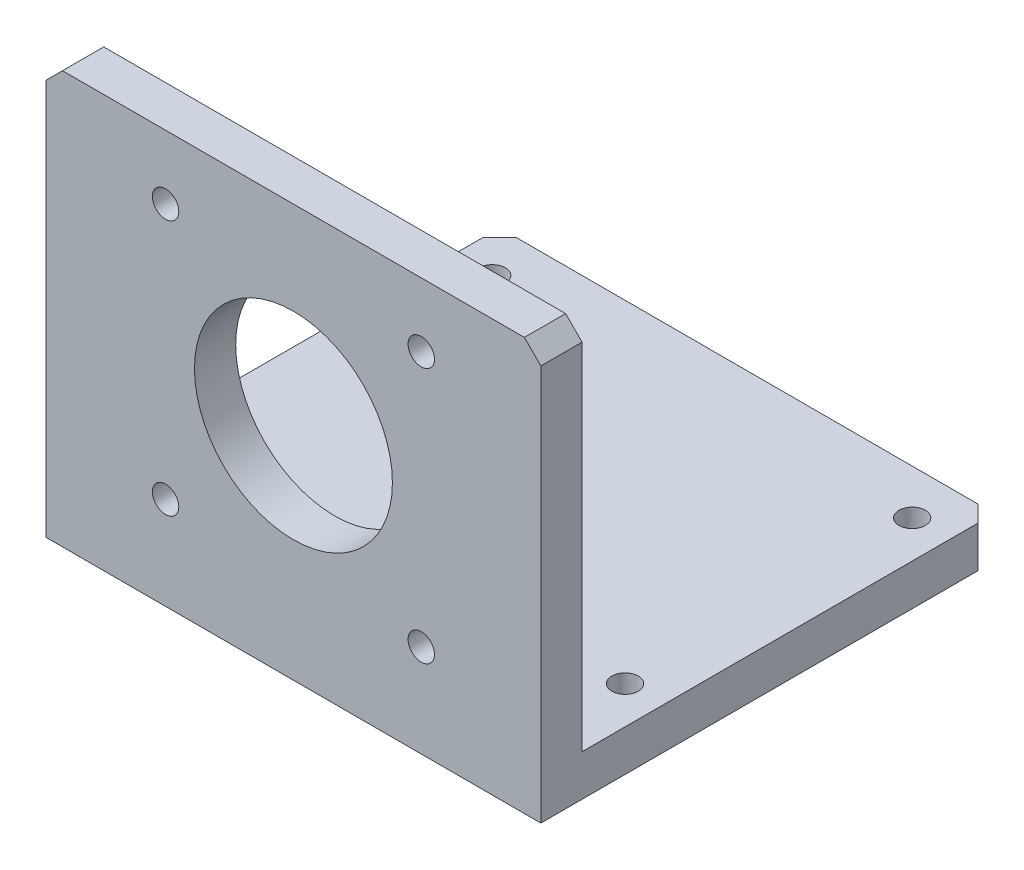
from build123d import *

# Parameters (mm, degrees)
EXTRUDE_1_DEPTH     = 60
HOLE_WIZARD_2_D     = 24
HOLE_WIZARD_3_D     = 3.2
HOLE_WIZARD_4_D     = 3.2
SKETCH_14_W         = 60
SKETCH_14_H         = 5
CUT_EXTRUDE_1_DEPTH = 5
CHAMFER_1_SIZE      = 2


with BuildPart() as part:
    # 草图1 → 凸台-拉伸1 (new body)
    with BuildSketch(Plane(origin=(0, 0, 0), x_dir=(0, 0, -1), z_dir=(1, 0, 0))):
        Polygon((0, 0), (0, 50), (5, 50), (5, 5), (60, 5), (60, 0), align=None)
    extrude(amount=EXTRUDE_1_DEPTH)

    # 孔2 (through all)
    with Locations(Plane.XY):
        with Locations((30, 26.75)):
            Hole(HOLE_WIZARD_2_D / 2)

    # 孔3 (through all)
    with Locations(Plane.XY):
        with Locations((14.5, 42.25), (45.5, 42.25), (45.5, 11.25), (14.5, 11.25)):
            Hole(HOLE_WIZARD_3_D / 2)

    # 孔4 (through all)
    with Locations(Plane(origin=(0, 5, 0), x_dir=(1, 0, 0), z_dir=(0, 1, 0))):
        with Locations((55.459259259, 14.749042146), (55.459259259, 49.557471264), (4.540740741, 14.749042146), (4.540740741, 49.557471264)):
            Hole(HOLE_WIZARD_4_D / 2)

    # 草图14 → 切除-拉伸1 (cut)
    with BuildSketch(Plane(origin=(0, 0, -60), x_dir=(-1, 0, 0), z_dir=(0, 0, -1))):
        with Locations((-30, 2.5)):
            Rectangle(SKETCH_14_W, SKETCH_14_H)
    extrude(amount=-CUT_EXTRUDE_1_DEPTH, mode=Mode.SUBTRACT)

    # 倒角1
    chamfer_1_edges = [part.edges().sort_by_distance(p)[0] for p in [
        (0, 2.5, -55),
        (60, 50, -2.5),
        (0, 50, -2.5),
        (60, 2.5, -55),
    ]]
    chamfer(chamfer_1_edges, length=CHAMFER_1_SIZE)


solid = part.part
